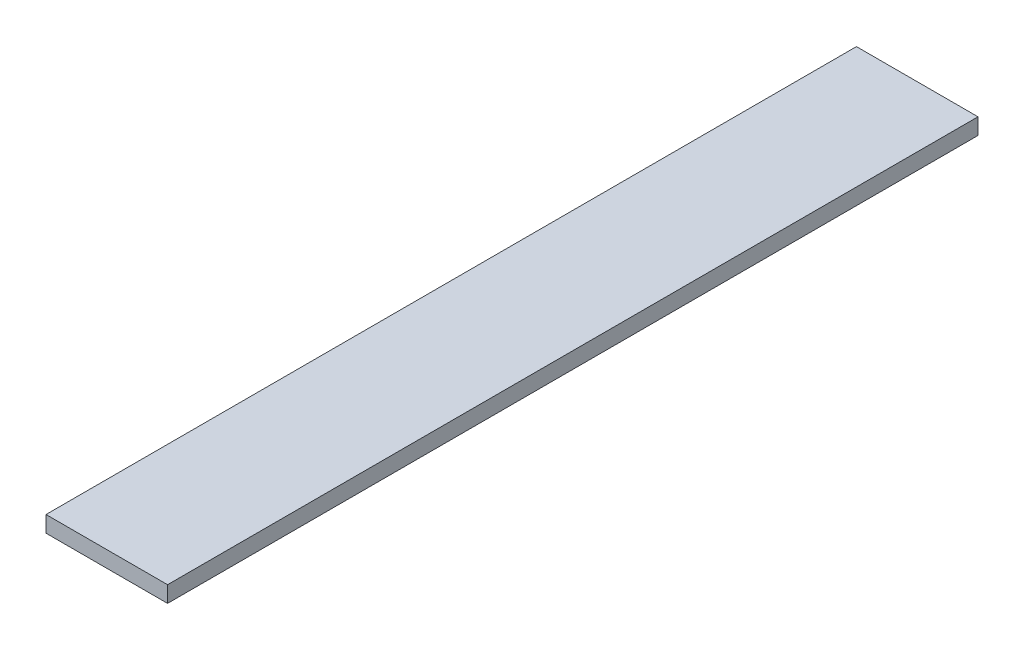
from build123d import *

# Parameters (mm, degrees)
SKETCH1_W           = 150
SKETCH1_H           = 20
BOSS_EXTRUDE1_DEPTH = 500


with BuildPart() as part:
    # Sketch1 → Boss-Extrude1 (new, symmetric)
    with BuildSketch(Plane.XY):
        Rectangle(SKETCH1_W, SKETCH1_H)
    extrude(amount=BOSS_EXTRUDE1_DEPTH, both=True)


solid = part.part
